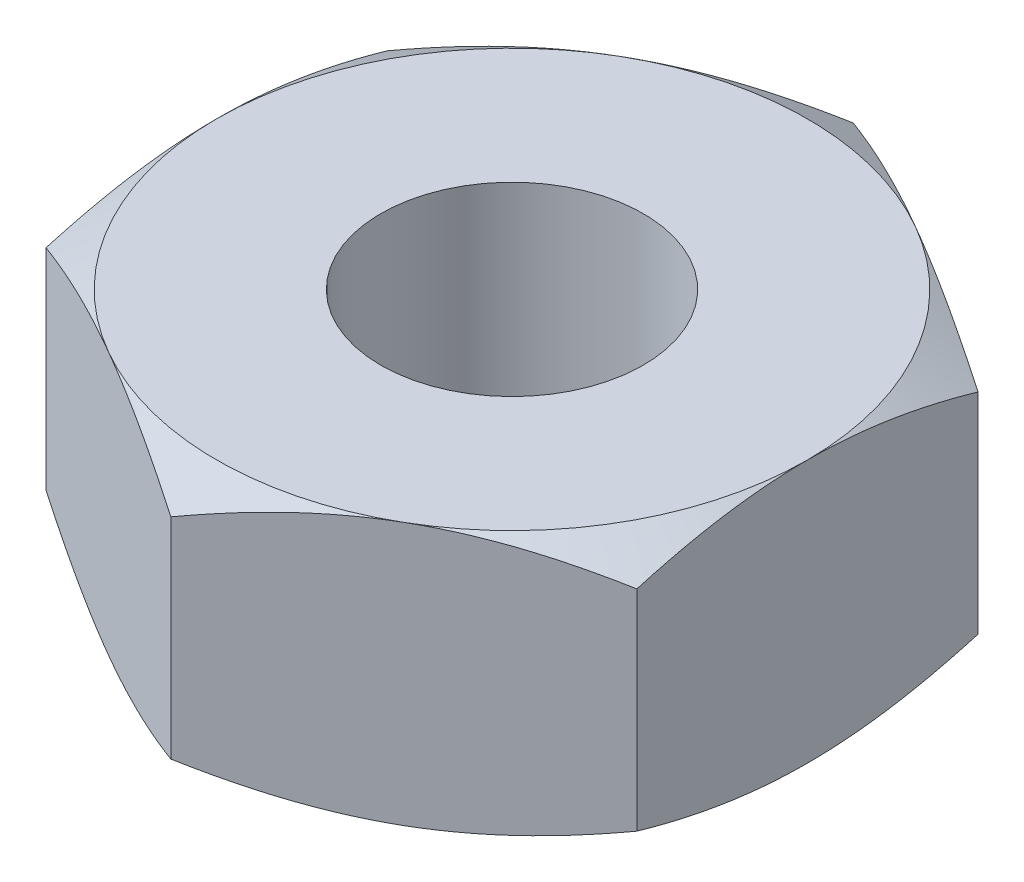
from build123d import *

# Parameters (mm, degrees)
SKETCH1_R           = 1
BOSS_EXTRUDE1_DEPTH = 2
SKETCH2_OUTSIDE_W   = 14.86
SKETCH2_OUTSIDE_H   = 15.556
SKETCH2_OUTSIDE_R   = 2.25
CUT_EXTRUDE1_DEPTH  = 2
CUT_EXTRUDE1_DRAFT  = -60
SKETCH3_OUTSIDE_W   = 14.86
SKETCH3_OUTSIDE_H   = 15.556
SKETCH3_OUTSIDE_R   = 2.25
CUT_EXTRUDE2_DEPTH  = 2
CUT_EXTRUDE2_DRAFT  = -60


with BuildPart() as part:
    # Sketch1 → Boss-Extrude1 (new body)
    with BuildSketch(Plane(origin=(0, 0, 0), x_dir=(1, 0, 0), z_dir=(0, 1, 0))):
        Polygon((0, -2.598076211), (2.25, -1.299038106), (2.25, 1.299038106), (0, 2.598076211), (-2.25, 1.299038106), (-2.25, -1.299038106), align=None)
        with Locations(Location((0, 0, 0), (0, 0, 270))):
            Circle(SKETCH1_R, mode=Mode.SUBTRACT)
    extrude(amount=BOSS_EXTRUDE1_DEPTH)


with BuildPart() as cut_extrude1_tool:
    # Sketch2 outside → Cut-Extrude1 (with draft: the straight prism first)
    with BuildSketch(Plane(origin=(0, 2, 0), x_dir=(1, 0, 0), z_dir=(0, 1, 0))):
        Rectangle(SKETCH2_OUTSIDE_W, SKETCH2_OUTSIDE_H)
        Circle(SKETCH2_OUTSIDE_R, mode=Mode.SUBTRACT)
    extrude(amount=-CUT_EXTRUDE1_DEPTH)
    # Cut-Extrude1: the draft: its side faces are tilted about the plane it starts from
    cut_extrude1_sides = [cut_extrude1_tool.faces().sort_by_distance(p)[0] for p in [
        (0, 1, 7.778),
        (7.43, 1, 0),
        (0, 1, -7.778),
        (-7.43, 1, 0),
        (-2.25, 1, 0),
    ]]
    draft(cut_extrude1_sides, Plane(origin=(0, 2, 0), x_dir=(1, 0, 0), z_dir=(0, 1, 0)), CUT_EXTRUDE1_DRAFT)


with BuildPart() as part_1:
    add(part.part)

    # Cut-Extrude1: cut by cut_extrude1_tool
    add(cut_extrude1_tool.part, mode=Mode.SUBTRACT)


with BuildPart() as cut_extrude2_tool:
    # Sketch3 outside → Cut-Extrude2 (with draft: the straight prism first)
    with BuildSketch(Plane.XZ):
        Rectangle(SKETCH3_OUTSIDE_W, SKETCH3_OUTSIDE_H)
        Circle(SKETCH3_OUTSIDE_R, mode=Mode.SUBTRACT)
    extrude(amount=-CUT_EXTRUDE2_DEPTH)
    # Cut-Extrude2: the draft: its side faces are tilted about the plane it starts from
    cut_extrude2_sides = [cut_extrude2_tool.faces().sort_by_distance(p)[0] for p in [
        (0, 1, -7.778),
        (7.43, 1, 0),
        (0, 1, 7.778),
        (-7.43, 1, 0),
        (-2.25, 1, 0),
    ]]
    draft(cut_extrude2_sides, Plane.XZ, CUT_EXTRUDE2_DRAFT)


with BuildPart() as part_2:
    add(part_1.part)

    # Cut-Extrude2: cut by cut_extrude2_tool
    add(cut_extrude2_tool.part, mode=Mode.SUBTRACT)


solid = part_2.part
